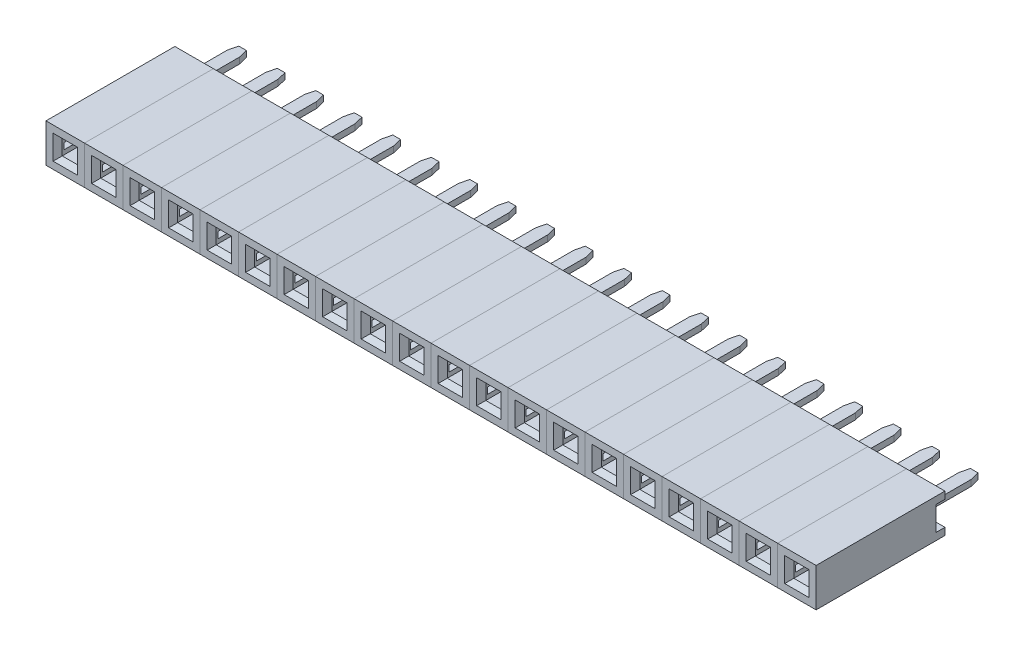
from build123d import *

# Parameters (mm, degrees)
SKETCH_1_W          = 2.54
SKETCH_1_H          = 2.54
EXTRUDE_1_DEPTH     = 8.5
SKETCH_2_W          = 2
SKETCH_2_H          = 0.42
CUT_EXTRUDE_1_DEPTH = 8.08
SKETCH_3_W          = 1
SKETCH_3_H          = 1
CUT_EXTRUDE_2_DEPTH = 6.5
SKETCH_4_W          = 0.6
SKETCH_4_H          = 1.6
CUT_EXTRUDE_3_DEPTH = 10.227849154
EXTRUDE_2_DEPTH     = 0.2
CHAMFER_1_SIZE      = 0.3
SKETCH1_W           = 0.8
SKETCH1_H           = 0.4
BOSS_EXTRUDE1_DEPTH = 3.2
CUT_EXTRUDE1_DEPTH  = 1
LPATTERN1_COUNT     = 20
LPATTERN1_PITCH     = 2.54


with BuildPart() as part:
    # Эскиз1 → Бобышка-Вытянуть1 (new body)
    with BuildSketch(Plane.XY):
        with Locations((0, 1.27)):
            Rectangle(SKETCH_1_W, SKETCH_1_H)
    extrude(amount=EXTRUDE_1_DEPTH)

    # Эскиз2 → Вырез-Вытянуть1 (cut)
    with BuildSketch(Plane(origin=(0, 0, 0), x_dir=(-1, 0, 0), z_dir=(0, 0, -1))):
        with Locations((0, 1.27)):
            Rectangle(SKETCH_2_W, SKETCH_2_H)
    extrude(amount=-CUT_EXTRUDE_1_DEPTH, mode=Mode.SUBTRACT)

    # Эскиз3 → Вырез-Вытянуть2 (cut)
    with BuildSketch(Plane.XY.offset(8.5)):
        with Locations((0, 1.27)):
            Rectangle(SKETCH_3_W, SKETCH_3_H)
    extrude(amount=-CUT_EXTRUDE_2_DEPTH, mode=Mode.SUBTRACT)

    # Эскиз4 → Вырез-Вытянуть3 (cut, through all)
    with BuildSketch(Plane.ZY.offset(1.27)):
        with Locations((0.3, 1.27)):
            Rectangle(SKETCH_4_W, SKETCH_4_H)
    extrude(amount=-CUT_EXTRUDE_3_DEPTH, mode=Mode.SUBTRACT)

    # Фаска1
    chamfer_1_edges = [part.edges().sort_by_distance(p)[0] for p in [
        (0.5, 1.27, 8.5),
        (0, 1.77, 8.5),
        (-0.5, 1.27, 8.5),
        (0, 0.77, 8.5),
    ]]
    chamfer(chamfer_1_edges, length=CHAMFER_1_SIZE)



with BuildPart() as body_2:
    # Эскиз6 → Бобышка-Вытянуть2 (new, symmetric)
    with BuildSketch(Plane(origin=(0, 1.27, 0), x_dir=(-1, 0, 0), z_dir=(0, -1, 0))):
        with BuildLine():
            Line((-0.4, 0), (0.4, 0))
            Line((0.4, 0), (0.4, -0.6))
            Line((0.4, -0.6), (0.6, -0.6))
            Line((0.6, -0.6), (1, -0.85))
            Line((1, -0.85), (1, -2.6))
            Line((1, -2.6), (0.813333333, -6.1))
            Line((0.813333333, -6.1), (0.45, -6.75))
            Line((0.45, -6.75), (0.3, -6.35))
            Line((0.3, -6.35), (0.5, -2.6))
            Line((0.5, -2.6), (0.5, -1.7))
            ThreePointArc((0.5, -1.7), (0, -1.2), (-0.5, -1.7))
            Line((-0.5, -1.7), (-0.5, -2.6))
            Line((-0.5, -2.6), (-0.3, -6.35))
            Line((-0.3, -6.35), (-0.45, -6.75))
            Line((-0.45, -6.75), (-0.813333333, -6.1))
            Line((-0.813333333, -6.1), (-1, -2.6))
            Line((-1, -2.6), (-1, -0.85))
            Line((-1, -0.85), (-0.6, -0.6))
            Line((-0.6, -0.6), (-0.4, -0.6))
            Line((-0.4, -0.6), (-0.4, 0))
        make_face()
    extrude(amount=EXTRUDE_2_DEPTH, both=True)


with BuildPart() as part_1:
    add(part.part)

    add(body_2.part)  # Boss-Extrude1 merges body 2
    # Sketch1 → Boss-Extrude1 (add)
    with BuildSketch(Plane(origin=(0, 0, 0), x_dir=(-1, 0, 0), z_dir=(0, 0, -1))):
        with Locations((0, 1.27)):
            Rectangle(SKETCH1_W, SKETCH1_H)
    extrude(amount=BOSS_EXTRUDE1_DEPTH)

    # Sketch2 → Cut-Extrude1 (cut)
    with BuildSketch(Plane(origin=(0, 1.47, 0), x_dir=(1, 0, 0), z_dir=(0, 1, 0))):
        Polygon((-0.4, 2.6), (-0.25, 3.2), (-0.4, 3.2), align=None)
        Polygon((0.4, 3.2), (0.25, 3.2), (0.4, 2.6), align=None)
        Polygon((0.25, 3.323331364), (0.25, 3.2), (0.4, 3.2), (0.4, 2.6), (0.533335502, 2.6), (0.533335502, 3.323331364), align=None)
        Polygon((-0.4, 3.2), (-0.25, 3.2), (-0.25, 3.209490078), (-0.25, 3.323331364), (-0.533335502, 3.323331364), (-0.533335502, 2.6), (-0.4, 2.6), align=None)
    extrude(amount=-CUT_EXTRUDE1_DEPTH, mode=Mode.SUBTRACT)


with BuildPart() as lpattern1_1:
    # LPattern1: pattern copy
    add(part_1.part.moved(Location(Vector(1, 0, 0) * (1 * LPATTERN1_PITCH))))


with BuildPart() as lpattern1_2:
    # LPattern1: pattern copy
    add(part_1.part.moved(Location(Vector(1, 0, 0) * (2 * LPATTERN1_PITCH))))


with BuildPart() as lpattern1_3:
    # LPattern1: pattern copy
    add(part_1.part.moved(Location(Vector(1, 0, 0) * (3 * LPATTERN1_PITCH))))


with BuildPart() as lpattern1_4:
    # LPattern1: pattern copy
    add(part_1.part.moved(Location(Vector(1, 0, 0) * (4 * LPATTERN1_PITCH))))


with BuildPart() as lpattern1_5:
    # LPattern1: pattern copy
    add(part_1.part.moved(Location(Vector(1, 0, 0) * (5 * LPATTERN1_PITCH))))


with BuildPart() as lpattern1_6:
    # LPattern1: pattern copy
    add(part_1.part.moved(Location(Vector(1, 0, 0) * (6 * LPATTERN1_PITCH))))


with BuildPart() as lpattern1_7:
    # LPattern1: pattern copy
    add(part_1.part.moved(Location(Vector(1, 0, 0) * (7 * LPATTERN1_PITCH))))


with BuildPart() as lpattern1_8:
    # LPattern1: pattern copy
    add(part_1.part.moved(Location(Vector(1, 0, 0) * (8 * LPATTERN1_PITCH))))


with BuildPart() as lpattern1_9:
    # LPattern1: pattern copy
    add(part_1.part.moved(Location(Vector(1, 0, 0) * (9 * LPATTERN1_PITCH))))


with BuildPart() as lpattern1_10:
    # LPattern1: pattern copy
    add(part_1.part.moved(Location(Vector(1, 0, 0) * (10 * LPATTERN1_PITCH))))


with BuildPart() as lpattern1_11:
    # LPattern1: pattern copy
    add(part_1.part.moved(Location(Vector(1, 0, 0) * (11 * LPATTERN1_PITCH))))


with BuildPart() as lpattern1_12:
    # LPattern1: pattern copy
    add(part_1.part.moved(Location(Vector(1, 0, 0) * (12 * LPATTERN1_PITCH))))


with BuildPart() as lpattern1_13:
    # LPattern1: pattern copy
    add(part_1.part.moved(Location(Vector(1, 0, 0) * (13 * LPATTERN1_PITCH))))


with BuildPart() as lpattern1_14:
    # LPattern1: pattern copy
    add(part_1.part.moved(Location(Vector(1, 0, 0) * (14 * LPATTERN1_PITCH))))


with BuildPart() as lpattern1_15:
    # LPattern1: pattern copy
    add(part_1.part.moved(Location(Vector(1, 0, 0) * (15 * LPATTERN1_PITCH))))


with BuildPart() as lpattern1_16:
    # LPattern1: pattern copy
    add(part_1.part.moved(Location(Vector(1, 0, 0) * (16 * LPATTERN1_PITCH))))


with BuildPart() as lpattern1_17:
    # LPattern1: pattern copy
    add(part_1.part.moved(Location(Vector(1, 0, 0) * (17 * LPATTERN1_PITCH))))


with BuildPart() as lpattern1_18:
    # LPattern1: pattern copy
    add(part_1.part.moved(Location(Vector(1, 0, 0) * (18 * LPATTERN1_PITCH))))


with BuildPart() as lpattern1_19:
    # LPattern1: pattern copy
    add(part_1.part.moved(Location(Vector(1, 0, 0) * (19 * LPATTERN1_PITCH))))


solid = Compound([part_1.part, lpattern1_1.part, lpattern1_2.part, lpattern1_3.part, lpattern1_4.part, lpattern1_5.part, lpattern1_6.part, lpattern1_7.part, lpattern1_8.part, lpattern1_9.part, lpattern1_10.part, lpattern1_11.part, lpattern1_12.part, lpattern1_13.part, lpattern1_14.part, lpattern1_15.part, lpattern1_16.part, lpattern1_17.part, lpattern1_18.part, lpattern1_19.part])
